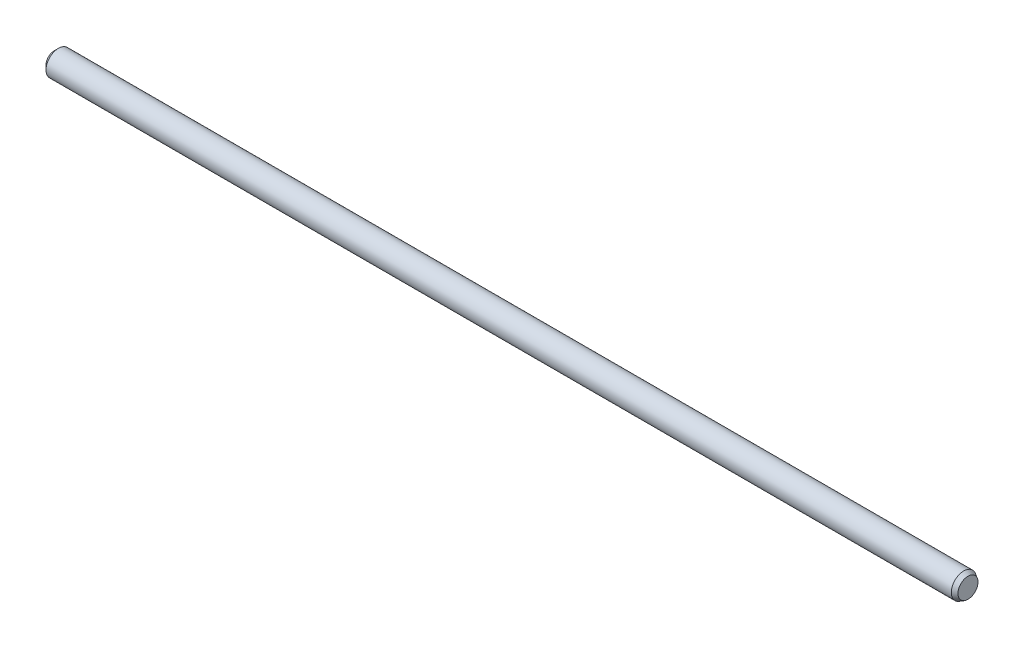
from build123d import *

# Parameters (mm, degrees)
CROQUIS1_R              = 1.475
SALIENTE_EXTRUIR1_DEPTH = 108
CHAFL_N1_SIZE           = 0.5
CHAFL_N1_SIZE2          = 0.288675135
CHAFL_N2_SIZE           = 0.5


with BuildPart() as part:
    # Croquis1 → Saliente-Extruir1 (new body)
    with BuildSketch(Plane(origin=(0, 0, 0), x_dir=(0, 0, -1), z_dir=(1, 0, 0))):
        Circle(CROQUIS1_R)
    extrude(amount=SALIENTE_EXTRUIR1_DEPTH)

    # Chaflán1
    chafl_n1_edges = [part.edges().sort_by_distance(p)[0] for p in [
        (108, 0, 1.475),
    ]]
    chafl_n1_side = [part.faces().sort_by_distance(p)[0] for p in [
        (54, 0, 1.475),
    ]]
    chamfer(chafl_n1_edges, length=CHAFL_N1_SIZE, length2=CHAFL_N1_SIZE2, reference=chafl_n1_side[0])

    # Chaflán2
    chafl_n2_edges = [part.edges().sort_by_distance(p)[0] for p in [
        (0, 0, 1.475),
    ]]
    chamfer(chafl_n2_edges, length=CHAFL_N2_SIZE)


solid = part.part
